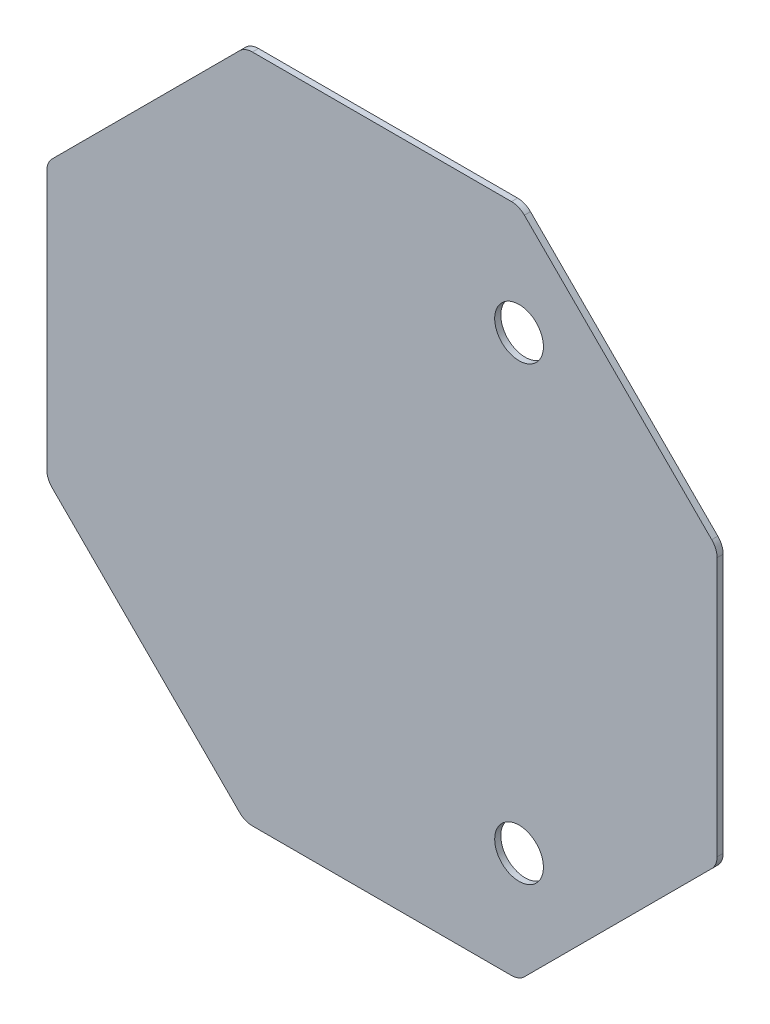
from build123d import *

# Parameters (mm, degrees)
SKETCH3_R           = 4
BOSS_EXTRUDE1_DEPTH = 1


with BuildPart() as part:
    # Sketch3 → Boss-Extrude1 (new body)
    with BuildSketch(Plane.XY):
        with BuildLine():
            Line((55, -21.257359313), (55, 21.257359313))
            ThreePointArc((55, 21.257359313), (54.771638598, 22.40540961), (54.121320344, 23.378679656))
            Line((54.121320344, 23.378679656), (23.378679656, 54.121320344))
            ThreePointArc((23.378679656, 54.121320344), (22.40540961, 54.771638598), (21.257359313, 55))
            Line((21.257359313, 55), (-21.257359313, 55))
            ThreePointArc((-21.257359313, 55), (-22.40540961, 54.771638598), (-23.378679656, 54.121320344))
            Line((-23.378679656, 54.121320344), (-54.121320344, 23.378679656))
            ThreePointArc((-54.121320344, 23.378679656), (-54.771638598, 22.40540961), (-55, 21.257359313))
            Line((-55, 21.257359313), (-55, -21.257359313))
            ThreePointArc((-55, -21.257359313), (-54.771638598, -22.40540961), (-54.121320344, -23.378679656))
            Line((-54.121320344, -23.378679656), (-23.378679656, -54.121320344))
            ThreePointArc((-23.378679656, -54.121320344), (-22.40540961, -54.771638598), (-21.257359313, -55))
            Line((-21.257359313, -55), (21.257359313, -55))
            ThreePointArc((21.257359313, -55), (22.40540961, -54.771638598), (23.378679656, -54.121320344))
            Line((23.378679656, -54.121320344), (54.121320344, -23.378679656))
            ThreePointArc((54.121320344, -23.378679656), (54.771638598, -22.40540961), (55, -21.257359313))
        make_face()
        with Locations((22.5, 37)):
            Circle(SKETCH3_R, mode=Mode.SUBTRACT)
        with Locations(Location((22.5, -37, 0), (0, 0, 180))):
            Circle(SKETCH3_R, mode=Mode.SUBTRACT)
    extrude(amount=BOSS_EXTRUDE1_DEPTH)


solid = part.part
